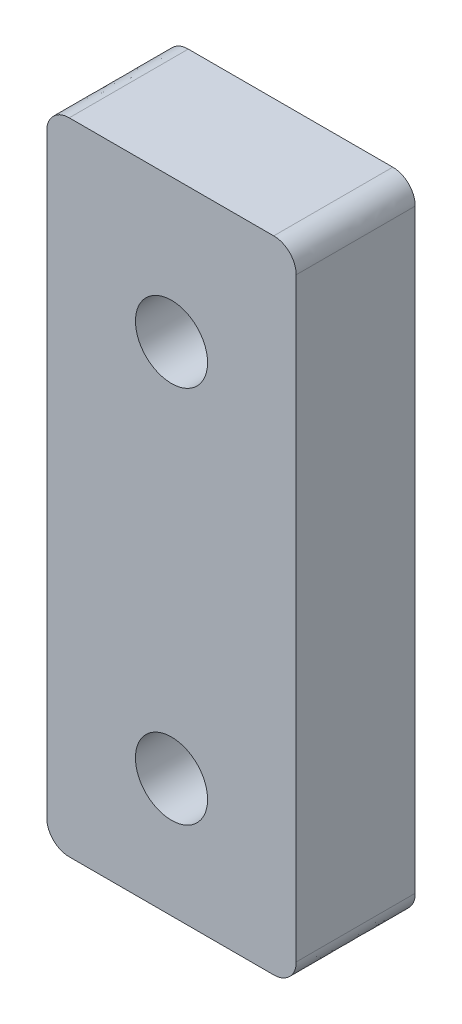
from build123d import *

# Parameters (mm, degrees)
MODEL_R             = 1.9243
MODEL_R_2           = 1.92515
BOSS_EXTRUDE1_DEPTH = 6.35


with BuildPart() as part:
    # Model → Boss-Extrude1 (new body)
    with BuildSketch(Plane.XY):
        with BuildLine():
            Line((-255.7004, 141.5182), (-244.7908, 141.5182))
            add(Edge.make_bspline(
                [(-244.7908, 141.5182), (-244.1268, 141.5182), (-243.5919, 140.9838), (-243.5919, 140.3197)],
                knots=[0.111111111, 0.111111111, 0.111111111, 0.111111111, 0.222222222, 0.222222222, 0.222222222, 0.222222222], degree=3))
            Line((-243.5919, 140.3197), (-243.5919, 108.5737))
            add(Edge.make_bspline(
                [(-243.5919, 108.5737), (-243.5919, 107.9096), (-244.1268, 107.3747), (-244.7908, 107.3747)],
                knots=[0.333333333, 0.333333333, 0.333333333, 0.333333333, 0.444444444, 0.444444444, 0.444444444, 0.444444444], degree=3))
            Line((-244.7908, 107.3747), (-255.7004, 107.3747))
            add(Edge.make_bspline(
                [(-255.7004, 107.3747), (-256.3648, 107.3747), (-256.8997, 107.9096), (-256.8997, 108.5737)],
                knots=[0.555555556, 0.555555556, 0.555555556, 0.555555556, 0.666666667, 0.666666667, 0.666666667, 0.666666667], degree=3))
            Line((-256.8997, 108.5737), (-256.8997, 140.3197))
            add(Edge.make_bspline(
                [(-256.8997, 140.3197), (-256.8997, 140.9838), (-256.3648, 141.5182), (-255.7004, 141.5182)],
                knots=[0.777777778, 0.777777778, 0.777777778, 0.777777778, 1, 1, 1, 1], degree=3))
        make_face()
        with Locations((-250.245, 133.8944)):
            Circle(MODEL_R, mode=Mode.SUBTRACT)
        with Locations((-250.245, 113.71655)):
            Circle(MODEL_R_2, mode=Mode.SUBTRACT)
    extrude(amount=BOSS_EXTRUDE1_DEPTH)


solid = part.part
